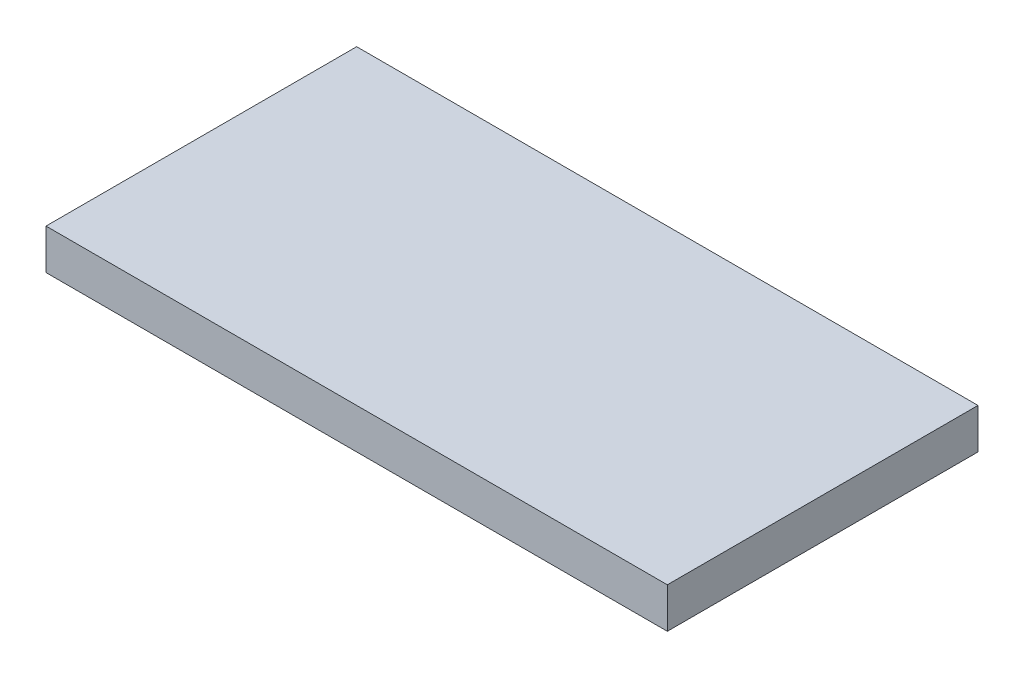
from build123d import *

# Parameters (mm, degrees)
SKETCH1_W                                  = 256
SKETCH1_H                                  = 128
SKETCH1_W_2                                = 16
SKETCH1_H_2                                = 8
SKETCH1_W_3                                = 8.5
SKETCH1_H_3                                = 28
SKETCH1_R                                  = 2.1
BOSS_EXTRUDE1_DEPTH                        = 16.6
SKETCH1_3_W                                = 8.5
SKETCH1_3_H                                = 28
SKETCH1_3_W_2                              = 16
SKETCH1_3_H_2                              = 8
CUT_EXTRUDE1_DEPTH                         = 11.3
SKETCH1_4_R                                = 2.1
CUT_EXTRUDE2_DEPTH                         = 2
SKETCH1_5_R                                = 2.1
BOSS_EXTRUDE2_DEPTH                        = 2
SKETCH1_6_R                                = 2.1
CUT_EXTRUDE3_DEPTH                         = 6.75
MIRROR1_AT_THE_SECOND_PLANE_COPY_1_SKETC_R = 2.1
MIRROR1_AT_THE_SECOND_PLANE_COPY_1_DEPTH   = 2
MIRROR1_AT_THE_SECOND_PLANE_COPY_2_SKETC_R = 2.1
MIRROR1_AT_THE_SECOND_PLANE_COPY_2_DEPTH   = 6.75


with BuildPart() as part:
    # Sketch1 → Boss-Extrude1 (new body)
    # profile 1 of 12: a face of its own
    with BuildSketch(Plane(origin=(0, 0, 0), x_dir=(1, 0, 0), z_dir=(0, 1, 0))):
        Rectangle(SKETCH1_W, SKETCH1_H)
        with BuildLine():
            ThreePointArc((-119, 59), (-122.181980515, 57.681980515), (-123.5, 54.5))
            Line((-123.5, 54.5), (-123.5, -54.5))
            ThreePointArc((-123.5, -54.5), (-122.181980515, -57.681980515), (-119, -59))
            Line((-119, -59), (119, -59))
            ThreePointArc((119, -59), (122.181980515, -57.681980515), (123.5, -54.5))
            Line((123.5, -54.5), (123.5, 54.5))
            ThreePointArc((123.5, 54.5), (122.181980515, 57.681980515), (119, 59))
            Line((119, 59), (-119, 59))
        make_face(mode=Mode.SUBTRACT)
    # profile 2 of 12: a face of its own
    with BuildSketch(Plane(origin=(0, 0, 0), x_dir=(1, 0, 0), z_dir=(0, 1, 0))):
        with BuildLine():
            Line((119, 59), (-119, 59))
            ThreePointArc((-119, 59), (-122.181980515, 57.681980515), (-123.5, 54.5))
            Line((-123.5, 54.5), (-123.5, -54.5))
            ThreePointArc((-123.5, -54.5), (-122.181980515, -57.681980515), (-119, -59))
            Line((-119, -59), (119, -59))
            ThreePointArc((119, -59), (122.181980515, -57.681980515), (123.5, -54.5))
            Line((123.5, -54.5), (123.5, 54.5))
            ThreePointArc((123.5, 54.5), (122.181980515, 57.681980515), (119, 59))
        make_face()
        with BuildLine():
            ThreePointArc((-112.616086562, 47.25), (-110.25, 51.5), (-112.616086562, 55.75))
            Line((-112.616086562, 55.75), (-117.883913438, 55.75))
            ThreePointArc((-117.883913438, 55.75), (-120.25, 51.5), (-117.883913438, 47.25))
            Line((-117.883913438, 47.25), (-112.616086562, 47.25))
        make_face(mode=Mode.SUBTRACT)
        with BuildLine():
            ThreePointArc((-111, 2.633913438), (-115.25, 5), (-119.5, 2.633913438))
            Line((-119.5, 2.633913438), (-119.5, -2.633913438))
            ThreePointArc((-119.5, -2.633913438), (-115.25, -5), (-111, -2.633913438))
            Line((-111, -2.633913438), (-111, 2.633913438))
        make_face(mode=Mode.SUBTRACT)
        with BuildLine():
            ThreePointArc((-36.116086562, 47.25), (-33.75, 51.5), (-36.116086562, 55.75))
            Line((-36.116086562, 55.75), (-41.383913438, 55.75))
            ThreePointArc((-41.383913438, 55.75), (-43.75, 51.5), (-41.383913438, 47.25))
            Line((-41.383913438, 47.25), (-36.116086562, 47.25))
        make_face(mode=Mode.SUBTRACT)
        with BuildLine():
            ThreePointArc((-97.65, 43.65), (-104.721067812, 40.721067812), (-107.65, 33.65))
            Line((-107.65, 33.65), (-107.65, -33.65))
            ThreePointArc((-107.65, -33.65), (-104.721067812, -40.721067812), (-97.65, -43.65))
            Line((-97.65, -43.65), (97.65, -43.65))
            ThreePointArc((97.65, -43.65), (104.721067812, -40.721067812), (107.65, -33.65))
            Line((107.65, -33.65), (107.65, 33.65))
            ThreePointArc((107.65, 33.65), (104.721067812, 40.721067812), (97.65, 43.65))
            Line((97.65, 43.65), (-97.65, 43.65))
        make_face(mode=Mode.SUBTRACT)
    # profile 3 of 12: a face of its own
    with BuildSketch(Plane(origin=(0, 0, 0), x_dir=(1, 0, 0), z_dir=(0, 1, 0))):
        with BuildLine():
            Line((97.65, 43.65), (-97.65, 43.65))
            ThreePointArc((-97.65, 43.65), (-104.721067812, 40.721067812), (-107.65, 33.65))
            Line((-107.65, 33.65), (-107.65, -33.65))
            ThreePointArc((-107.65, -33.65), (-104.721067812, -40.721067812), (-97.65, -43.65))
            Line((-97.65, -43.65), (97.65, -43.65))
            ThreePointArc((97.65, -43.65), (104.721067812, -40.721067812), (107.65, -33.65))
            Line((107.65, -33.65), (107.65, 33.65))
            ThreePointArc((107.65, 33.65), (104.721067812, 40.721067812), (97.65, 43.65))
        make_face()
        with Locations((-36.5, 6)):
            Rectangle(SKETCH1_W_2, SKETCH1_H_2, mode=Mode.SUBTRACT)
        with Locations((-99.1, 0)):
            Rectangle(SKETCH1_W_3, SKETCH1_H_3, mode=Mode.SUBTRACT)
    # profile 4 of 12: a face of its own
    with BuildSketch(Plane(origin=(0, 0, 0), x_dir=(1, 0, 0), z_dir=(0, 1, 0))):
        with Locations((-99.1, 0)):
            Rectangle(SKETCH1_W_3, SKETCH1_H_3)
    # profile 5 of 12: a face of its own
    with BuildSketch(Plane(origin=(0, 0, 0), x_dir=(1, 0, 0), z_dir=(0, 1, 0))):
        with Locations((-36.5, 6)):
            Rectangle(SKETCH1_W_2, SKETCH1_H_2)
    # profile 6 of 12: a face of its own
    with BuildSketch(Plane(origin=(0, 0, 0), x_dir=(1, 0, 0), z_dir=(0, 1, 0))):
        with BuildLine():
            Line((-41.383913438, 47.25), (-36.116086562, 47.25))
            ThreePointArc((-36.116086562, 47.25), (-33.75, 51.5), (-36.116086562, 55.75))
            Line((-36.116086562, 55.75), (-41.383913438, 55.75))
            ThreePointArc((-41.383913438, 55.75), (-43.75, 51.5), (-41.383913438, 47.25))
        make_face()
        with Locations((-38.75, 51.5)):
            Circle(SKETCH1_R, mode=Mode.SUBTRACT)
    # profile 7 of 12: a face of its own
    with BuildSketch(Plane(origin=(0, 0, 0), x_dir=(1, 0, 0), z_dir=(0, 1, 0))):
        with Locations((-38.75, 51.5)):
            Circle(SKETCH1_R)
    # profile 8 of 12: a face of its own
    with BuildSketch(Plane(origin=(0, 0, 0), x_dir=(1, 0, 0), z_dir=(0, 1, 0))):
        with BuildLine():
            Line((-111, -2.633913438), (-111, 2.633913438))
            ThreePointArc((-111, 2.633913438), (-115.25, 5), (-119.5, 2.633913438))
            Line((-119.5, 2.633913438), (-119.5, -2.633913438))
            ThreePointArc((-119.5, -2.633913438), (-115.25, -5), (-111, -2.633913438))
        make_face()
        with Locations((-115.25, 0)):
            Circle(SKETCH1_R, mode=Mode.SUBTRACT)
    # profile 9 of 12: a face of its own
    with BuildSketch(Plane(origin=(0, 0, 0), x_dir=(1, 0, 0), z_dir=(0, 1, 0))):
        with Locations((-115.25, 0)):
            Circle(SKETCH1_R)
    # profile 10 of 12: a face of its own
    with BuildSketch(Plane(origin=(0, 0, 0), x_dir=(1, 0, 0), z_dir=(0, 1, 0))):
        with BuildLine():
            Line((-117.883913438, 47.25), (-112.616086562, 47.25))
            ThreePointArc((-112.616086562, 47.25), (-110.25, 51.5), (-112.616086562, 55.75))
            Line((-112.616086562, 55.75), (-117.883913438, 55.75))
            ThreePointArc((-117.883913438, 55.75), (-120.25, 51.5), (-117.883913438, 47.25))
        make_face()
        with Locations((-115.25, 51.5)):
            Circle(SKETCH1_R, mode=Mode.SUBTRACT)
    # profile 11 of 12: a face of its own
    with BuildSketch(Plane(origin=(0, 0, 0), x_dir=(1, 0, 0), z_dir=(0, 1, 0))):
        with Locations((-115.25, 51.5)):
            Circle(SKETCH1_R)
    # profile 12 of 12: a face of its own
    with BuildSketch(Plane(origin=(0, 0, 0), x_dir=(1, 0, 0), z_dir=(0, 1, 0))):
        with Locations((99.1, 0)):
            Rectangle(SKETCH1_W_3, SKETCH1_H_3)
    extrude(amount=BOSS_EXTRUDE1_DEPTH)

    # Sketch1<3> → Cut-Extrude1 (cut)
    with BuildSketch(Plane(origin=(0, 0, 0), x_dir=(1, 0, 0), z_dir=(0, 1, 0))):
        with BuildLine():
            Line((97.65, -43.65), (-97.65, -43.65))
            ThreePointArc((-97.65, -43.65), (-104.721067812, -40.721067812), (-107.65, -33.65))
            Line((-107.65, -33.65), (-107.65, 33.65))
            ThreePointArc((-107.65, 33.65), (-104.721067812, 40.721067812), (-97.65, 43.65))
            Line((-97.65, 43.65), (97.65, 43.65))
            ThreePointArc((97.65, 43.65), (104.721067812, 40.721067812), (107.65, 33.65))
            Line((107.65, 33.65), (107.65, -33.65))
            ThreePointArc((107.65, -33.65), (104.721067812, -40.721067812), (97.65, -43.65))
        make_face()
        with Locations((99.1, 0)):
            Rectangle(SKETCH1_3_W, SKETCH1_3_H, mode=Mode.SUBTRACT)
        with Locations((-99.1, 0)):
            Rectangle(SKETCH1_3_W, SKETCH1_3_H, mode=Mode.SUBTRACT)
        with Locations((-36.5, 6)):
            Rectangle(SKETCH1_3_W_2, SKETCH1_3_H_2, mode=Mode.SUBTRACT)
    extrude(amount=CUT_EXTRUDE1_DEPTH, mode=Mode.SUBTRACT)

    # Sketch1<4> → Cut-Extrude2 (cut)
    # profile 1 of 7: a face of its own
    with BuildSketch(Plane(origin=(0, 0, 0), x_dir=(1, 0, 0), z_dir=(0, 1, 0))):
        with BuildLine():
            Line((119, 59), (-119, 59))
            ThreePointArc((-119, 59), (-122.181980515, 57.681980515), (-123.5, 54.5))
            Line((-123.5, 54.5), (-123.5, -54.5))
            ThreePointArc((-123.5, -54.5), (-122.181980515, -57.681980515), (-119, -59))
            Line((-119, -59), (119, -59))
            ThreePointArc((119, -59), (122.181980515, -57.681980515), (123.5, -54.5))
            Line((123.5, -54.5), (123.5, 54.5))
            ThreePointArc((123.5, 54.5), (122.181980515, 57.681980515), (119, 59))
        make_face()
        with BuildLine():
            ThreePointArc((-112.616086562, 47.25), (-110.25, 51.5), (-112.616086562, 55.75))
            Line((-112.616086562, 55.75), (-117.883913438, 55.75))
            ThreePointArc((-117.883913438, 55.75), (-120.25, 51.5), (-117.883913438, 47.25))
            Line((-117.883913438, 47.25), (-112.616086562, 47.25))
        make_face(mode=Mode.SUBTRACT)
        with BuildLine():
            ThreePointArc((-111, 2.633913438), (-115.25, 5), (-119.5, 2.633913438))
            Line((-119.5, 2.633913438), (-119.5, -2.633913438))
            ThreePointArc((-119.5, -2.633913438), (-115.25, -5), (-111, -2.633913438))
            Line((-111, -2.633913438), (-111, 2.633913438))
        make_face(mode=Mode.SUBTRACT)
        with BuildLine():
            ThreePointArc((-36.116086562, 47.25), (-33.75, 51.5), (-36.116086562, 55.75))
            Line((-36.116086562, 55.75), (-41.383913438, 55.75))
            ThreePointArc((-41.383913438, 55.75), (-43.75, 51.5), (-41.383913438, 47.25))
            Line((-41.383913438, 47.25), (-36.116086562, 47.25))
        make_face(mode=Mode.SUBTRACT)
        with BuildLine():
            ThreePointArc((-97.65, 43.65), (-104.721067812, 40.721067812), (-107.65, 33.65))
            Line((-107.65, 33.65), (-107.65, -33.65))
            ThreePointArc((-107.65, -33.65), (-104.721067812, -40.721067812), (-97.65, -43.65))
            Line((-97.65, -43.65), (97.65, -43.65))
            ThreePointArc((97.65, -43.65), (104.721067812, -40.721067812), (107.65, -33.65))
            Line((107.65, -33.65), (107.65, 33.65))
            ThreePointArc((107.65, 33.65), (104.721067812, 40.721067812), (97.65, 43.65))
            Line((97.65, 43.65), (-97.65, 43.65))
        make_face(mode=Mode.SUBTRACT)
    # profile 2 of 7: a face of its own
    with BuildSketch(Plane(origin=(0, 0, 0), x_dir=(1, 0, 0), z_dir=(0, 1, 0))):
        with BuildLine():
            Line((-111, -2.633913438), (-111, 2.633913438))
            ThreePointArc((-111, 2.633913438), (-115.25, 5), (-119.5, 2.633913438))
            Line((-119.5, 2.633913438), (-119.5, -2.633913438))
            ThreePointArc((-119.5, -2.633913438), (-115.25, -5), (-111, -2.633913438))
        make_face()
        with Locations((-115.25, 0)):
            Circle(SKETCH1_4_R, mode=Mode.SUBTRACT)
    # profile 3 of 7: a face of its own
    with BuildSketch(Plane(origin=(0, 0, 0), x_dir=(1, 0, 0), z_dir=(0, 1, 0))):
        with Locations((-115.25, 0)):
            Circle(SKETCH1_4_R)
    # profile 4 of 7: a face of its own
    with BuildSketch(Plane(origin=(0, 0, 0), x_dir=(1, 0, 0), z_dir=(0, 1, 0))):
        with BuildLine():
            Line((-117.883913438, 47.25), (-112.616086562, 47.25))
            ThreePointArc((-112.616086562, 47.25), (-110.25, 51.5), (-112.616086562, 55.75))
            Line((-112.616086562, 55.75), (-117.883913438, 55.75))
            ThreePointArc((-117.883913438, 55.75), (-120.25, 51.5), (-117.883913438, 47.25))
        make_face()
        with Locations((-115.25, 51.5)):
            Circle(SKETCH1_4_R, mode=Mode.SUBTRACT)
    # profile 5 of 7: a face of its own
    with BuildSketch(Plane(origin=(0, 0, 0), x_dir=(1, 0, 0), z_dir=(0, 1, 0))):
        with Locations((-115.25, 51.5)):
            Circle(SKETCH1_4_R)
    # profile 6 of 7: a face of its own
    with BuildSketch(Plane(origin=(0, 0, 0), x_dir=(1, 0, 0), z_dir=(0, 1, 0))):
        with BuildLine():
            Line((-41.383913438, 47.25), (-36.116086562, 47.25))
            ThreePointArc((-36.116086562, 47.25), (-33.75, 51.5), (-36.116086562, 55.75))
            Line((-36.116086562, 55.75), (-41.383913438, 55.75))
            ThreePointArc((-41.383913438, 55.75), (-43.75, 51.5), (-41.383913438, 47.25))
        make_face()
        with Locations((-38.75, 51.5)):
            Circle(SKETCH1_4_R, mode=Mode.SUBTRACT)
    # profile 7 of 7: a face of its own
    with BuildSketch(Plane(origin=(0, 0, 0), x_dir=(1, 0, 0), z_dir=(0, 1, 0))):
        with Locations((-38.75, 51.5)):
            Circle(SKETCH1_4_R)
    extrude(amount=CUT_EXTRUDE2_DEPTH, mode=Mode.SUBTRACT)

    # Sketch1<5> → Boss-Extrude2 (add)
    # profile 1 of 6: a face of its own
    with BuildSketch(Plane(origin=(0, 0, 0), x_dir=(1, 0, 0), z_dir=(0, 1, 0))):
        with BuildLine():
            Line((-111, -2.633913438), (-111, 2.633913438))
            ThreePointArc((-111, 2.633913438), (-115.25, 5), (-119.5, 2.633913438))
            Line((-119.5, 2.633913438), (-119.5, -2.633913438))
            ThreePointArc((-119.5, -2.633913438), (-115.25, -5), (-111, -2.633913438))
        make_face()
        with Locations((-115.25, 0)):
            Circle(SKETCH1_5_R, mode=Mode.SUBTRACT)
    # profile 2 of 6: a face of its own
    with BuildSketch(Plane(origin=(0, 0, 0), x_dir=(1, 0, 0), z_dir=(0, 1, 0))):
        with BuildLine():
            Line((-117.883913438, 47.25), (-112.616086562, 47.25))
            ThreePointArc((-112.616086562, 47.25), (-110.25, 51.5), (-112.616086562, 55.75))
            Line((-112.616086562, 55.75), (-117.883913438, 55.75))
            ThreePointArc((-117.883913438, 55.75), (-120.25, 51.5), (-117.883913438, 47.25))
        make_face()
        with Locations((-115.25, 51.5)):
            Circle(SKETCH1_5_R, mode=Mode.SUBTRACT)
    # profile 3 of 6: a face of its own
    with BuildSketch(Plane(origin=(0, 0, 0), x_dir=(1, 0, 0), z_dir=(0, 1, 0))):
        with Locations((-115.25, 0)):
            Circle(SKETCH1_5_R)
    # profile 4 of 6: a face of its own
    with BuildSketch(Plane(origin=(0, 0, 0), x_dir=(1, 0, 0), z_dir=(0, 1, 0))):
        with Locations((-115.25, 51.5)):
            Circle(SKETCH1_5_R)
    # profile 5 of 6: a face of its own
    with BuildSketch(Plane(origin=(0, 0, 0), x_dir=(1, 0, 0), z_dir=(0, 1, 0))):
        with BuildLine():
            Line((-41.383913438, 47.25), (-36.116086562, 47.25))
            ThreePointArc((-36.116086562, 47.25), (-33.75, 51.5), (-36.116086562, 55.75))
            Line((-36.116086562, 55.75), (-41.383913438, 55.75))
            ThreePointArc((-41.383913438, 55.75), (-43.75, 51.5), (-41.383913438, 47.25))
        make_face()
        with Locations((-38.75, 51.5)):
            Circle(SKETCH1_5_R, mode=Mode.SUBTRACT)
    # profile 6 of 6: a face of its own
    with BuildSketch(Plane(origin=(0, 0, 0), x_dir=(1, 0, 0), z_dir=(0, 1, 0))):
        with Locations((-38.75, 51.5)):
            Circle(SKETCH1_5_R)
    boss_extrude2 = extrude(amount=BOSS_EXTRUDE2_DEPTH)

    # Sketch1<6> → Cut-Extrude3 (cut)
    with BuildSketch(Plane(origin=(0, 0, 0), x_dir=(1, 0, 0), z_dir=(0, 1, 0))):
        with Locations(Location((-115.25, 0, 0), (0, 0, 270))):
            Circle(SKETCH1_6_R)
        with Locations(Location((-115.25, 51.5, 0), (0, 0, 270))):
            Circle(SKETCH1_6_R)
        with Locations(Location((-38.75, 51.5, 0), (0, 0, 270))):
            Circle(SKETCH1_6_R)
    cut_extrude3 = extrude(amount=CUT_EXTRUDE3_DEPTH, mode=Mode.SUBTRACT)

    # Mirror1: Boss-Extrude2, Cut-Extrude3 across plane
    add(boss_extrude2.mirror(Plane.XY))
    add(cut_extrude3.mirror(Plane.XY), mode=Mode.SUBTRACT)

    # Mirror1 at the second plane: Boss-Extrude2, Cut-Extrude3 across plane
    add(boss_extrude2.mirror(Plane(origin=(0, 0, 0), x_dir=(0, 0, 1), z_dir=(1, 0, 0))))
    add(cut_extrude3.mirror(Plane(origin=(0, 0, 0), x_dir=(0, 0, 1), z_dir=(1, 0, 0))), mode=Mode.SUBTRACT)

    # Mirror1 at the second plane copy 1 sketc → Mirror1 at the second plane copy 1 (add)
    # profile 1 of 6: a face of its own
    with BuildSketch(Plane(origin=(0, 0, 0), x_dir=(-1, 0, 0), z_dir=(0, 1, 0))):
        with BuildLine():
            Line((-111, -2.633913438), (-111, 2.633913438))
            ThreePointArc((-111, 2.633913438), (-115.25, 5), (-119.5, 2.633913438))
            Line((-119.5, 2.633913438), (-119.5, -2.633913438))
            ThreePointArc((-119.5, -2.633913438), (-115.25, -5), (-111, -2.633913438))
        make_face()
        with Locations((-115.25, 0)):
            Circle(MIRROR1_AT_THE_SECOND_PLANE_COPY_1_SKETC_R, mode=Mode.SUBTRACT)
    # profile 2 of 6: a face of its own
    with BuildSketch(Plane(origin=(0, 0, 0), x_dir=(-1, 0, 0), z_dir=(0, 1, 0))):
        with BuildLine():
            Line((-117.883913438, 47.25), (-112.616086562, 47.25))
            ThreePointArc((-112.616086562, 47.25), (-110.25, 51.5), (-112.616086562, 55.75))
            Line((-112.616086562, 55.75), (-117.883913438, 55.75))
            ThreePointArc((-117.883913438, 55.75), (-120.25, 51.5), (-117.883913438, 47.25))
        make_face()
        with Locations((-115.25, 51.5)):
            Circle(MIRROR1_AT_THE_SECOND_PLANE_COPY_1_SKETC_R, mode=Mode.SUBTRACT)
    # profile 3 of 6: a face of its own
    with BuildSketch(Plane(origin=(0, 0, 0), x_dir=(-1, 0, 0), z_dir=(0, 1, 0))):
        with Locations((-115.25, 0)):
            Circle(MIRROR1_AT_THE_SECOND_PLANE_COPY_1_SKETC_R)
    # profile 4 of 6: a face of its own
    with BuildSketch(Plane(origin=(0, 0, 0), x_dir=(-1, 0, 0), z_dir=(0, 1, 0))):
        with Locations((-115.25, 51.5)):
            Circle(MIRROR1_AT_THE_SECOND_PLANE_COPY_1_SKETC_R)
    # profile 5 of 6: a face of its own
    with BuildSketch(Plane(origin=(0, 0, 0), x_dir=(-1, 0, 0), z_dir=(0, 1, 0))):
        with BuildLine():
            Line((-41.383913438, 47.25), (-36.116086562, 47.25))
            ThreePointArc((-36.116086562, 47.25), (-33.75, 51.5), (-36.116086562, 55.75))
            Line((-36.116086562, 55.75), (-41.383913438, 55.75))
            ThreePointArc((-41.383913438, 55.75), (-43.75, 51.5), (-41.383913438, 47.25))
        make_face()
        with Locations((-38.75, 51.5)):
            Circle(MIRROR1_AT_THE_SECOND_PLANE_COPY_1_SKETC_R, mode=Mode.SUBTRACT)
    # profile 6 of 6: a face of its own
    with BuildSketch(Plane(origin=(0, 0, 0), x_dir=(-1, 0, 0), z_dir=(0, 1, 0))):
        with Locations((-38.75, 51.5)):
            Circle(MIRROR1_AT_THE_SECOND_PLANE_COPY_1_SKETC_R)
    extrude(amount=MIRROR1_AT_THE_SECOND_PLANE_COPY_1_DEPTH)

    # Mirror1 at the second plane copy 2 sketc → Mirror1 at the second plane copy 2 (cut)
    with BuildSketch(Plane(origin=(0, 0, 0), x_dir=(-1, 0, 0), z_dir=(0, 1, 0))):
        with Locations(Location((-115.25, 0, 0), (0, 0, 270))):
            Circle(MIRROR1_AT_THE_SECOND_PLANE_COPY_2_SKETC_R)
        with Locations(Location((-115.25, 51.5, 0), (0, 0, 270))):
            Circle(MIRROR1_AT_THE_SECOND_PLANE_COPY_2_SKETC_R)
        with Locations(Location((-38.75, 51.5, 0), (0, 0, 270))):
            Circle(MIRROR1_AT_THE_SECOND_PLANE_COPY_2_SKETC_R)
    extrude(amount=MIRROR1_AT_THE_SECOND_PLANE_COPY_2_DEPTH, mode=Mode.SUBTRACT)


solid = part.part
